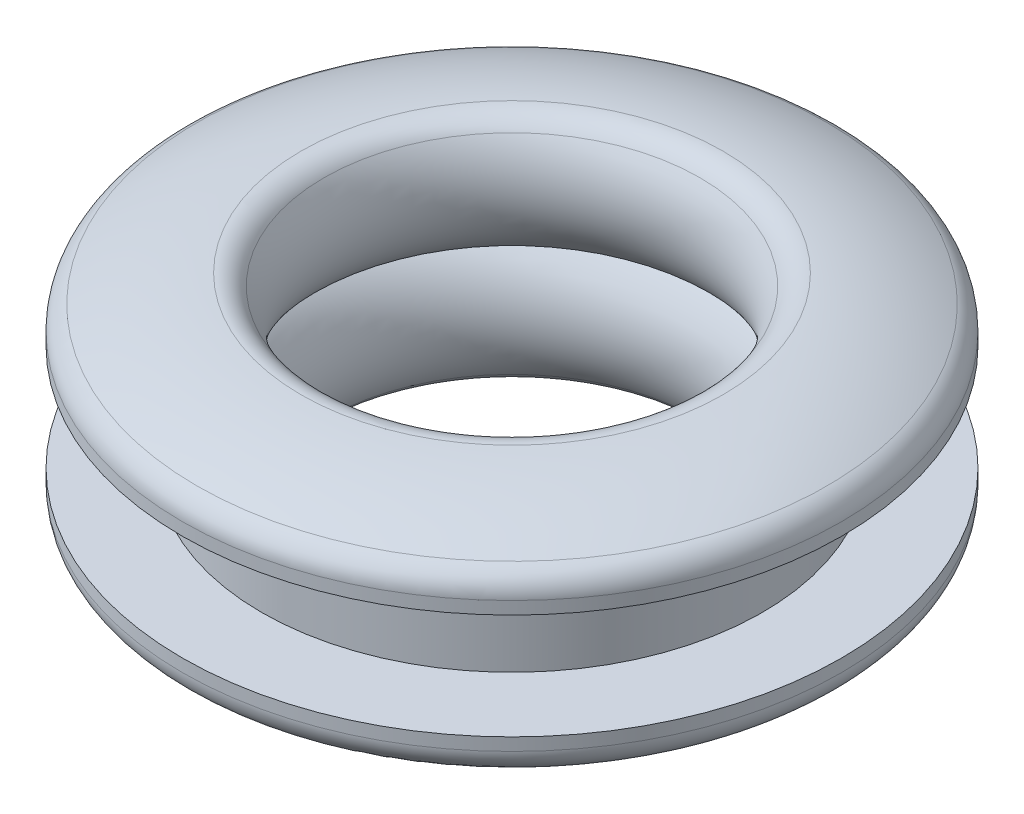
from build123d import *

# Parameters (mm, degrees)
FILLET_1_R = 10


with BuildPart() as part:
    # 草图1 → 旋转2 (revolve)
    with BuildSketch(Plane.XY, mode=Mode.PRIVATE) as revolve_2_sk:
        with BuildLine():
            Line((50, -24.78924415), (50, -20))
            Line((50, -20), (20, -20))
            Line((20, -20), (20, 0))
            Line((20, 0), (0, 0))
            ThreePointArc((0, 0), (-9.147216169, -22.083333333), (0, -44.166666667))
            ThreePointArc((0, -44.166666667), (22.824721633, -41.526987549), (44.444444444, -33.747308314))
            ThreePointArc((44.444444444, -33.747308314), (48.498365856, -30.059706917), (50, -24.78924415))
        make_face()
    revolve(revolve_2_sk.sketch.rotate(Axis((-75, 0, 0), (0, -1, 0)), 90), axis=Axis((-75, 0, 0), (0, -1, 0)))

    # 镜向1: part across plane


with BuildPart() as part_1:
    add(part.part)
    add(part.part.mirror(Plane.ZX))

    # 圆角1
    fillet_1_edges = [part_1.edges().sort_by_distance(p)[0] for p in [
        (-75, 44.166666667, -75),
        (-75, -44.166666667, -75),
    ]]
    fillet(fillet_1_edges, radius=FILLET_1_R)


solid = part_1.part
